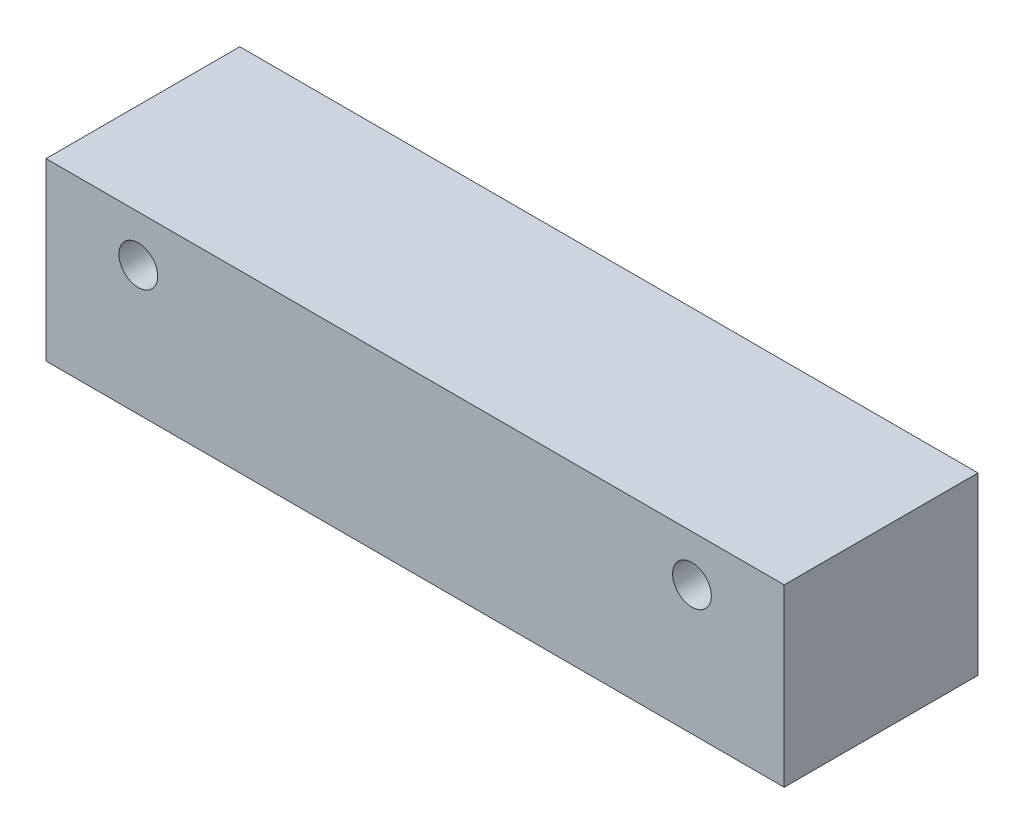
from build123d import *

# Parameters (mm, degrees)
SKETCH1_W             = 80
SKETCH1_H             = 19
BOSS_EXTRUDE1_DEPTH   = 10.5
M5X0_8_TAPPED_HOLE1_D = 4.2


with BuildPart() as part:
    # Sketch1 → Boss-Extrude1 (new, symmetric)
    with BuildSketch(Plane.XY):
        with Locations((40, 9.5)):
            Rectangle(SKETCH1_W, SKETCH1_H)
    extrude(amount=BOSS_EXTRUDE1_DEPTH, both=True)

    # M5x0.8 Tapped Hole1 (through all)
    with Locations(Plane.XY.offset(10.5)):
        with Locations((10, 14), (70, 14)):
            Hole(M5X0_8_TAPPED_HOLE1_D / 2)


solid = part.part
